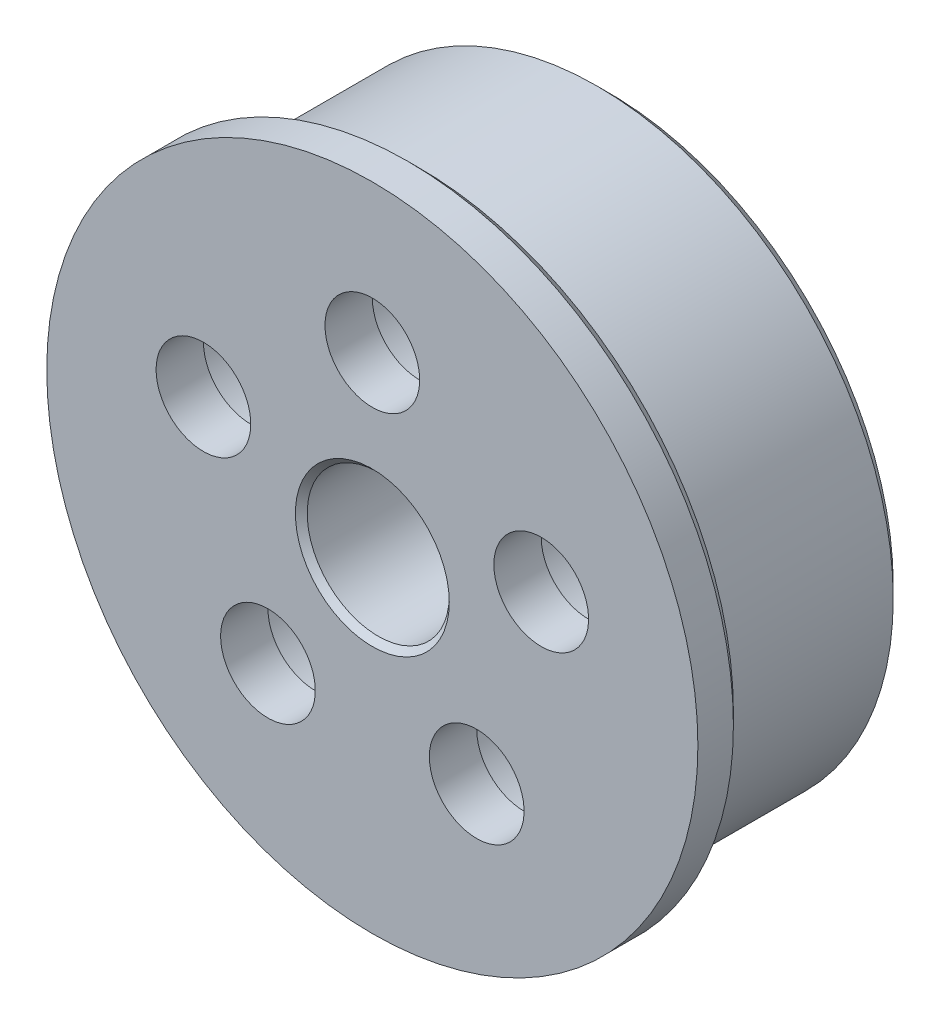
from build123d import *

# Parameters (mm, degrees)
SKETCH_1_R                   = 12.5
SKETCH_1_R_2                 = 1.5
EXTRUDE_1_DEPTH              = 10
EXTRUDE_START                = -2
SKETCH_3_R                   = 13.75
SKETCH_3_R_2                 = 12.5
EXTRUDE_3_DEPTH              = 2
SKETCH_4_R                   = 3
CUT_EXTRUDE_1_DEPTH          = 22.866069606
HOLE_WIZARD_M3_1_D           = 4
HOLE_WIZARD_M3_1_CBORE_D     = 7
HOLE_WIZARD_M3_1_CBORE_DEPTH = 8
CHAMFER_1_SIZE               = 0.5
CHAMFER_2_SIZE               = 0.25


with BuildPart() as part:
    # ｽｹｯﾁ1 → ﾎﾞｽ - 押し出し1 (new body)
    with BuildSketch(Plane.XY):
        Circle(SKETCH_1_R)
        with Locations((0, 7.5)):
            Circle(SKETCH_1_R_2, mode=Mode.SUBTRACT)
        with Locations((7.132923872, 2.317627458)):
            Circle(SKETCH_1_R_2, mode=Mode.SUBTRACT)
        with Locations((4.408389392, -6.067627458)):
            Circle(SKETCH_1_R_2, mode=Mode.SUBTRACT)
        with Locations((-4.408389392, -6.067627458)):
            Circle(SKETCH_1_R_2, mode=Mode.SUBTRACT)
        with Locations((-7.132923872, 2.317627458)):
            Circle(SKETCH_1_R_2, mode=Mode.SUBTRACT)
    extrude(amount=EXTRUDE_1_DEPTH)

    # ｽｹｯﾁ3 → ﾎﾞｽ - 押し出し3 (add)
    with BuildSketch(Plane.XY.offset(10).offset(EXTRUDE_START)):
        Circle(SKETCH_3_R)
        Circle(SKETCH_3_R_2, mode=Mode.SUBTRACT)
    extrude(amount=EXTRUDE_3_DEPTH)

    # ｽｹｯﾁ4 → ｶｯﾄ - 押し出し1 (cut, through all)
    with BuildSketch(Plane(origin=(0, 0, 0), x_dir=(-1, 0, 0), z_dir=(0, 0, -1))):
        Circle(SKETCH_4_R)
    extrude(amount=-CUT_EXTRUDE_1_DEPTH, mode=Mode.SUBTRACT)

    # M3 穴付きねじ用座ぐり穴1 (through all)
    with Locations(Plane(origin=(0, 0, 0), x_dir=(-1, 0, 0), z_dir=(0, 0, -1))):
        with Locations((0, 7.5), (7.132923872, 2.317627458), (4.408389392, -6.067627458), (-4.408389392, -6.067627458), (-7.132923872, 2.317627458)):
            CounterBoreHole(HOLE_WIZARD_M3_1_D / 2, HOLE_WIZARD_M3_1_CBORE_D / 2, HOLE_WIZARD_M3_1_CBORE_DEPTH)

    # 面取り1
    chamfer_1_edges = [part.edges().sort_by_distance(p)[0] for p in [
        (-12.5, 0, 0),
        (-13.75, 0, 8),
    ]]
    chamfer(chamfer_1_edges, length=CHAMFER_1_SIZE)

    # 面取り2
    chamfer_2_edges = [part.edges().sort_by_distance(p)[0] for p in [
        (3, 0, 10),
        (3, 0, 0),
        (10.632923872, 2.317627458, 0),
        (7.908389392, -6.067627458, 0),
        (-0.908389392, -6.067627458, 0),
        (-3.632923872, 2.317627458, 0),
        (3.5, 7.5, 0),
    ]]
    chamfer(chamfer_2_edges, length=CHAMFER_2_SIZE)


solid = part.part
